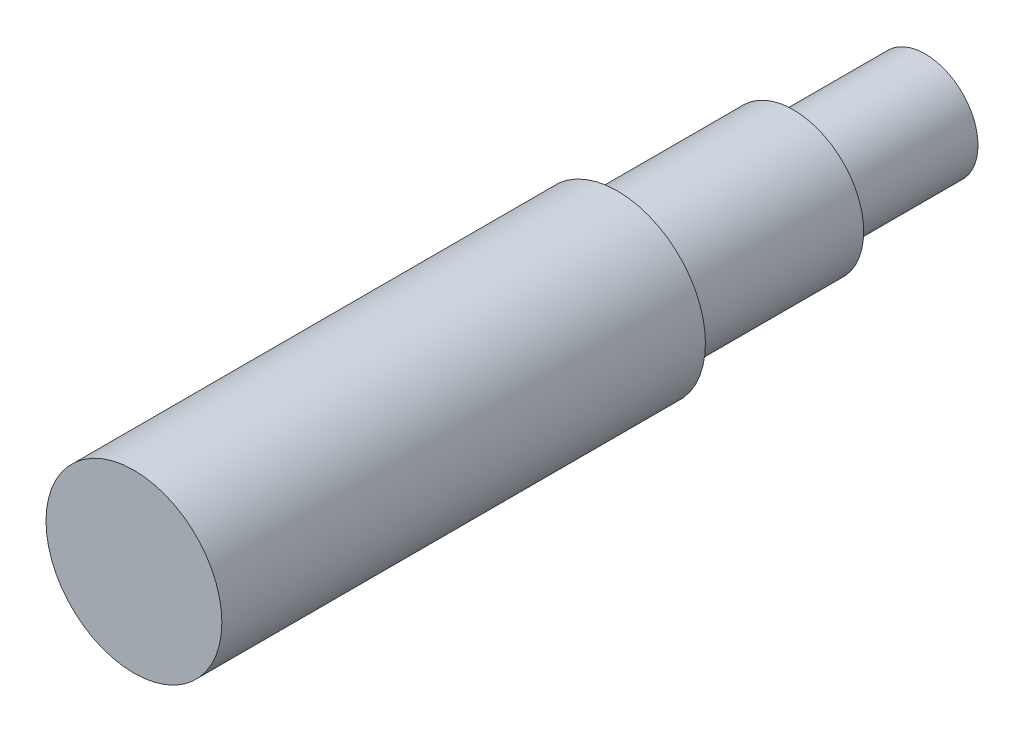
from build123d import *


with BuildPart() as part:
    # 草图1 → 旋转1 (revolve)
    with BuildSketch(Plane(origin=(0, 0, 0), x_dir=(0, 0, -1), z_dir=(1, 0, 0)), mode=Mode.PRIVATE) as revolve_1_sk:
        Polygon((0, 0), (0, 20), (110, 20), (110, 16), (150, 16), (150, 12), (180, 12), (180, 0), align=None)
    revolve(revolve_1_sk.sketch.rotate(Axis((0, 0, 0), (0, 0, -1)), 90), axis=Axis((0, 0, 0), (0, 0, -1)))


solid = part.part
